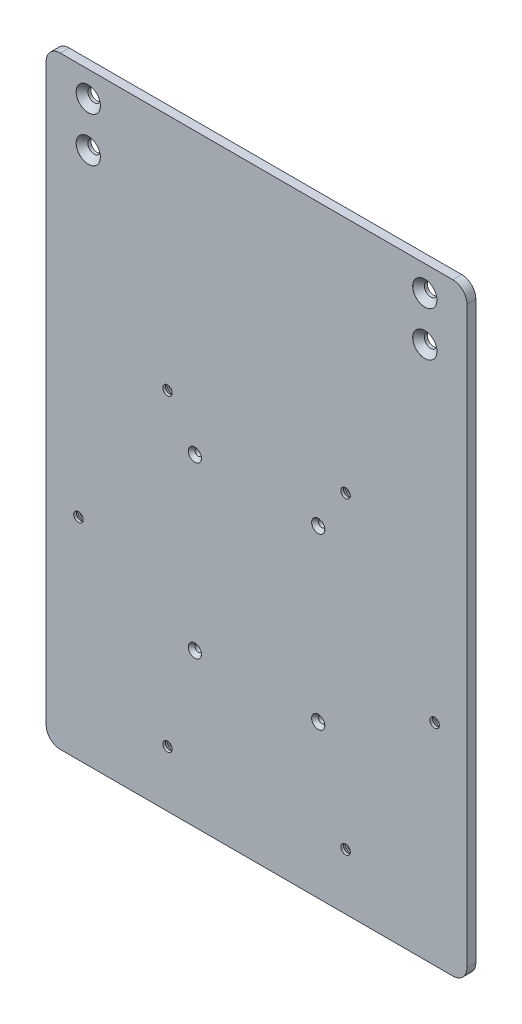
from build123d import *

# Parameters (mm, degrees)
BOSS_EXTRUDE1_DEPTH                             = 6.35
FILLET1_R                                       = 10
CSK_FOR_1_4_FLAT_HEAD_MACHINE_SCREW2_AT_COUNT   = 2
CSK_FOR_1_4_FLAT_HEAD_MACHINE_SCREW2_AT_PITCH   = 127
CSK_FOR_1_4_FLAT_HEAD_MACHINE_SCREW2_2_COUNT    = 2
CSK_FOR_1_4_FLAT_HEAD_MACHINE_SCREW2_2_PITCH    = 219.970452561
CSK_FOR_1_4_FLAT_HEAD_MACHINE_SCREW2_3_COUNT    = 2
CSK_FOR_1_4_FLAT_HEAD_MACHINE_SCREW2_3_PITCH    = 127
CSK_FOR_1_4_FLAT_HEAD_MACHINE_SCREW2_4_COUNT    = 2
CSK_FOR_1_4_FLAT_HEAD_MACHINE_SCREW2_4_PITCH    = 219.970452561
CSK_FOR_1_4_FLAT_HEAD_MACHINE_SCREW2_5_COUNT    = 2
CSK_FOR_1_4_FLAT_HEAD_MACHINE_SCREW2_5_PITCH    = 254
CSK_FOR_M8_FLAT_HEAD_MACHINE_SCREW3_AT_2_COUNT  = 2
CSK_FOR_M8_FLAT_HEAD_MACHINE_SCREW3_AT_2_PITCH  = 31.75
CSK_FOR_M8_FLAT_HEAD_MACHINE_SCREW3_AT_3_COUNT  = 2
CSK_FOR_M8_FLAT_HEAD_MACHINE_SCREW3_AT_3_PITCH  = 240
CSK_FOR_M8_FLAT_HEAD_MACHINE_SCREW3_AT_4_COUNT  = 2
CSK_FOR_M8_FLAT_HEAD_MACHINE_SCREW3_AT_4_PITCH  = 242.091021106
CSK_FOR_M4_FLAT_HEAD_MACHINE_SCREW1_D           = 4.5
CSK_FOR_M4_FLAT_HEAD_MACHINE_SCREW1_CSINK_D     = 9.4
CSK_FOR_M4_FLAT_HEAD_MACHINE_SCREW1_CSINK_ANGLE = 90


with BuildPart() as part:
    # Sketch1 → Boss-Extrude1 (new body)
    with BuildSketch(Plane.XY):
        Polygon((-51.407315296, 404.750822008), (158.112408435, 404.750822008), (158.112408435, -25.249177992), (-141.887591565, -25.249177992), (-141.887591565, 404.750822008), align=None)
    extrude(amount=BOSS_EXTRUDE1_DEPTH)

    # Fillet1
    fillet1_edges = [part.edges().sort_by_distance(p)[0] for p in [
        (158.112408435, 404.750822008, 3.175),
        (158.112408435, -25.249177992, 3.175),
        (-141.887591565, -25.249177992, 3.175),
        (-141.887591565, 404.750822008, 3.175),
    ]]
    fillet(fillet1_edges, radius=FILLET1_R)

    # Sketch18 → CSK for 1/4 Flat Head Machine Screw2 (revolve, cut)
    with BuildSketch(Plane(origin=(-55.387591565, 234.736048288, 0), x_dir=(0, 1, 0), z_dir=(1, 0, 0))):
        Polygon((0, 0), (0, 6.35), (3.3782, 6.35), (3.3782, 4.520932584), (6.4389, 1), (6.4389, 0), align=None)
    csk_for_1_4_flat_head_machine_screw2 = revolve(axis=Axis((-55.387591565, 234.736048288, -6.35), (0, 0, 1)), mode=Mode.SUBTRACT)

    # CSK for 1/4 Flat Head Machine Screw2 at: CSK for 1/4 Flat Head Machine Screw2 ×2
    with Locations(*[(i * CSK_FOR_1_4_FLAT_HEAD_MACHINE_SCREW2_AT_PITCH, 0, 0) for i in range(1, CSK_FOR_1_4_FLAT_HEAD_MACHINE_SCREW2_AT_COUNT)]):
        add(csk_for_1_4_flat_head_machine_screw2, mode=Mode.SUBTRACT)

    # CSK for 1_4 Flat Head Machine Screw2 2: CSK for 1/4 Flat Head Machine Screw2 ×2
    with Locations(*[Vector(0.8660254037844397, -0.49999999999999817, 0) * (i * CSK_FOR_1_4_FLAT_HEAD_MACHINE_SCREW2_2_PITCH) for i in range(1, CSK_FOR_1_4_FLAT_HEAD_MACHINE_SCREW2_2_COUNT)]):
        add(csk_for_1_4_flat_head_machine_screw2, mode=Mode.SUBTRACT)

    # CSK for 1_4 Flat Head Machine Screw2 3: CSK for 1/4 Flat Head Machine Screw2 ×2
    with Locations(*[Vector(-0.49999999999999784, -0.8660254037844399, 0) * (i * CSK_FOR_1_4_FLAT_HEAD_MACHINE_SCREW2_3_PITCH) for i in range(1, CSK_FOR_1_4_FLAT_HEAD_MACHINE_SCREW2_3_COUNT)]):
        add(csk_for_1_4_flat_head_machine_screw2, mode=Mode.SUBTRACT)

    # CSK for 1_4 Flat Head Machine Screw2 4: CSK for 1/4 Flat Head Machine Screw2 ×2
    with Locations(*[(0, -i * CSK_FOR_1_4_FLAT_HEAD_MACHINE_SCREW2_4_PITCH, 0) for i in range(1, CSK_FOR_1_4_FLAT_HEAD_MACHINE_SCREW2_4_COUNT)]):
        add(csk_for_1_4_flat_head_machine_screw2, mode=Mode.SUBTRACT)

    # CSK for 1_4 Flat Head Machine Screw2 5: CSK for 1/4 Flat Head Machine Screw2 ×2
    with Locations(*[Vector(0.5000000000000014, -0.8660254037844379, 0) * (i * CSK_FOR_1_4_FLAT_HEAD_MACHINE_SCREW2_5_PITCH) for i in range(1, CSK_FOR_1_4_FLAT_HEAD_MACHINE_SCREW2_5_COUNT)]):
        add(csk_for_1_4_flat_head_machine_screw2, mode=Mode.SUBTRACT)

    # Sketch28 → CSK for M8 Flat Head Machine Screw3 (revolve, cut)
    with BuildSketch(Plane(origin=(-111.887591565, 386.500822008, 6.35), x_dir=(0, -1, 0), z_dir=(1, 0, 0))):
        Polygon((0, 0), (0, 6.35), (4.5, 6.35), (4.5, 4.189370079), (8.65, 0.039370079), (8.65, 0), align=None)
    csk_for_m8_flat_head_machine_screw3 = revolve(axis=Axis((-111.887591565, 386.500822008, 12.7), (0, 0, -1)), mode=Mode.SUBTRACT)

    # CSK for M8 Flat Head Machine Screw3 at 2: CSK for M8 Flat Head Machine Screw3 ×2
    with Locations(*[(0, -i * CSK_FOR_M8_FLAT_HEAD_MACHINE_SCREW3_AT_2_PITCH, 0) for i in range(1, CSK_FOR_M8_FLAT_HEAD_MACHINE_SCREW3_AT_2_COUNT)]):
        add(csk_for_m8_flat_head_machine_screw3, mode=Mode.SUBTRACT)

    # CSK for M8 Flat Head Machine Screw3 at 3: CSK for M8 Flat Head Machine Screw3 ×2
    with Locations(*[(i * CSK_FOR_M8_FLAT_HEAD_MACHINE_SCREW3_AT_3_PITCH, 0, 0) for i in range(1, CSK_FOR_M8_FLAT_HEAD_MACHINE_SCREW3_AT_3_COUNT)]):
        add(csk_for_m8_flat_head_machine_screw3, mode=Mode.SUBTRACT)

    # CSK for M8 Flat Head Machine Screw3 at 4: CSK for M8 Flat Head Machine Screw3 ×2
    with Locations(*[Vector(0.9913626655951604, -0.13114901930269318, 0) * (i * CSK_FOR_M8_FLAT_HEAD_MACHINE_SCREW3_AT_4_PITCH) for i in range(1, CSK_FOR_M8_FLAT_HEAD_MACHINE_SCREW3_AT_4_COUNT)]):
        add(csk_for_m8_flat_head_machine_screw3, mode=Mode.SUBTRACT)

    # CSK for M4 Flat Head Machine Screw1 (through all)
    with Locations(Plane(origin=(-35.887591565, 204.750822008, 6.35), x_dir=(1, 0, 0), z_dir=(0, 0, 1))):
        with Locations((0, 0), (88, 0), (88, -121), (0, -121)):
            CounterSinkHole(CSK_FOR_M4_FLAT_HEAD_MACHINE_SCREW1_D / 2, CSK_FOR_M4_FLAT_HEAD_MACHINE_SCREW1_CSINK_D / 2, counter_sink_angle=CSK_FOR_M4_FLAT_HEAD_MACHINE_SCREW1_CSINK_ANGLE)


solid = part.part
